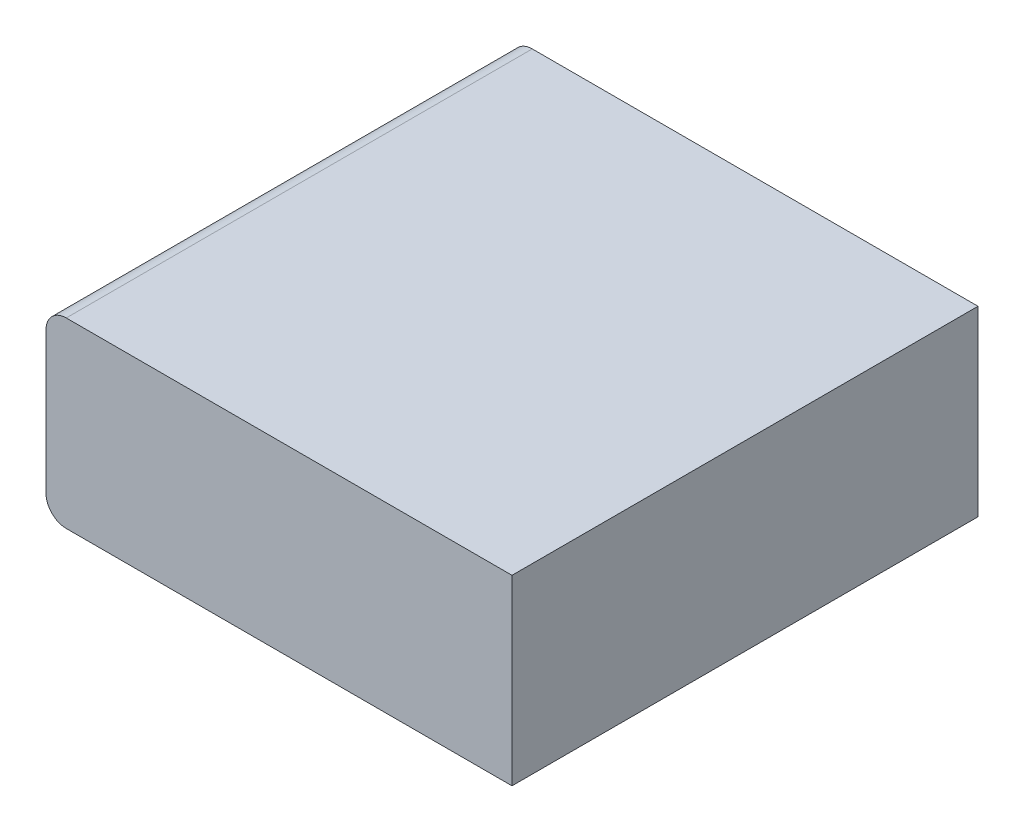
from build123d import *

# Parameters (mm, degrees)
SKETCH1_W           = 460
SKETCH1_H           = 460
BOSS_EXTRUDE1_DEPTH = 180
FILLET1_R           = 20


with BuildPart() as part:
    # Sketch1 → Boss-Extrude1 (new body)
    with BuildSketch(Plane(origin=(0, 0, 0), x_dir=(1, 0, 0), z_dir=(0, 1, 0))):
        with Locations((230, 230)):
            Rectangle(SKETCH1_W, SKETCH1_H)
    extrude(amount=BOSS_EXTRUDE1_DEPTH)

    # Fillet1
    fillet1_edges = [part.edges().sort_by_distance(p)[0] for p in [
        (0, 180, -230),
        (0, 0, -230),
    ]]
    fillet(fillet1_edges, radius=FILLET1_R)


solid = part.part
